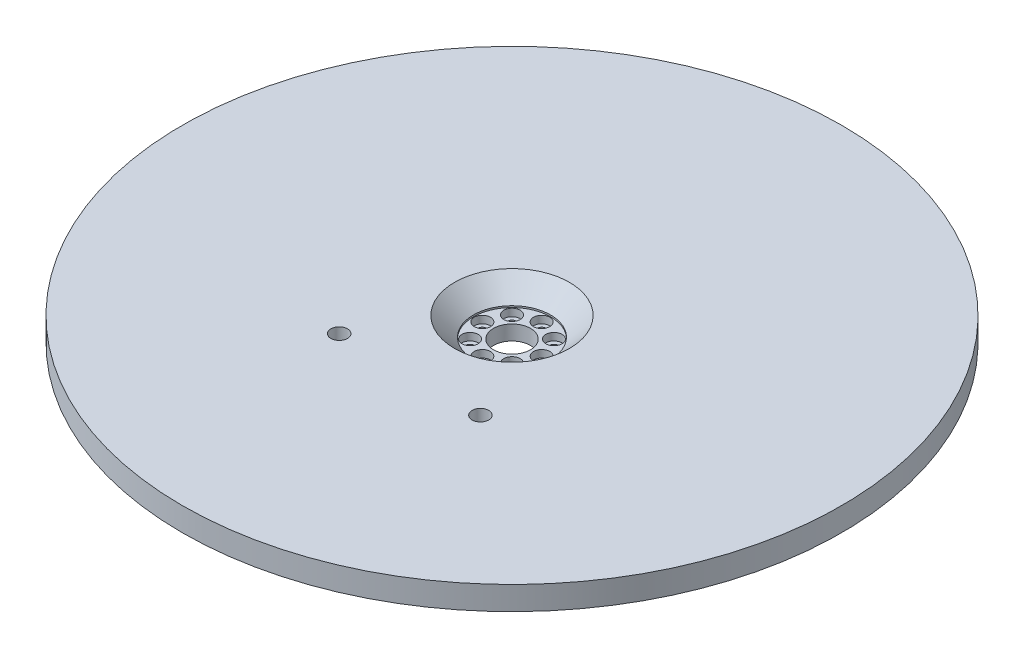
from build123d import *

# Parameters (mm, degrees)
SKETCH1_R                      = 88.9
BOSS_EXTRUDE1_DEPTH            = 3.175
SKETCH2_R                      = 12.065
BOSS_EXTRUDE2_DEPTH            = 3.175
SKETCH5_R                      = 10.4
CUT_EXTRUDE1_DEPTH             = 5.525
SKETCH6_R                      = 5
CUT_EXTRUDE2_DEPTH             = 4
CBORE_FOR_M2_SHCS1_D           = 2.2
CBORE_FOR_M2_SHCS1_DEPTH       = 6
CBORE_FOR_M2_SHCS1_CBORE_D     = 4.4
CBORE_FOR_M2_SHCS1_CBORE_DEPTH = 2
CBORE_FOR_M2_SHCS1_TIP         = 0.660946681
M4_CLEARANCE_HOLE1_D           = 4.5
CHAMFER1_SIZE                  = 5.08


with BuildPart() as part:
    # Sketch1 → Boss-Extrude1 (new, symmetric)
    with BuildSketch(Plane(origin=(0, 0, 0), x_dir=(1, 0, 0), z_dir=(0, 1, 0))):
        with Locations(Location((0, 0, 0), (0, 0, 270))):
            Circle(SKETCH1_R)
    extrude(amount=BOSS_EXTRUDE1_DEPTH, both=True)

    # Sketch2 → Boss-Extrude2 (add)
    with BuildSketch(Plane.XZ.offset(3.175)):
        with Locations(Location((0, 0, 0), (0, 0, 90))):
            Circle(SKETCH2_R)
    extrude(amount=BOSS_EXTRUDE2_DEPTH)

    # Sketch5 → Cut-Extrude1 (cut)
    with BuildSketch(Plane(origin=(0, 3.175, 0), x_dir=(1, 0, 0), z_dir=(0, 1, 0))):
        with Locations(Location((0, 0, 0), (0, 0, 270))):
            Circle(SKETCH5_R)
    extrude(amount=-CUT_EXTRUDE1_DEPTH, mode=Mode.SUBTRACT)

    # Sketch6 → Cut-Extrude2 (cut)
    with BuildSketch(Plane(origin=(0, -2.35, 0), x_dir=(1, 0, 0), z_dir=(0, 1, 0))):
        with Locations(Location((0, 0, 0), (0, 0, 270))):
            Circle(SKETCH6_R)
    extrude(amount=-CUT_EXTRUDE2_DEPTH, mode=Mode.SUBTRACT)

    # CBORE for M2 SHCS1
    with Locations(Plane(origin=(0, -2.35, 0), x_dir=(1, 0, 0), z_dir=(0, 1, 0))):
        with Locations((-5.65685425, 5.65685425), (0, 8), (5.65685425, 5.65685425), (8, 0), (5.65685425, -5.65685425), (0, -8), (-5.65685425, -5.65685425), (-8, 0)):
            CounterBoreHole(CBORE_FOR_M2_SHCS1_D / 2, CBORE_FOR_M2_SHCS1_CBORE_D / 2, CBORE_FOR_M2_SHCS1_CBORE_DEPTH, depth=CBORE_FOR_M2_SHCS1_DEPTH)
            with Locations((0, 0, -(CBORE_FOR_M2_SHCS1_DEPTH + CBORE_FOR_M2_SHCS1_TIP / 2))):  # 118° drill point
                Cone(0, CBORE_FOR_M2_SHCS1_D / 2, CBORE_FOR_M2_SHCS1_TIP, mode=Mode.SUBTRACT)

    # M4 Clearance Hole1 (through all)
    with Locations(Plane(origin=(0, 3.175, 0), x_dir=(1, 0, 0), z_dir=(0, 1, 0))):
        with Locations((19.05, -27.564242343), (-19.05, -27.564242343)):
            Hole(M4_CLEARANCE_HOLE1_D / 2)

    # Chamfer1
    chamfer1_edges = [part.edges().sort_by_distance(p)[0] for p in [
        (0, 3.175, -10.4),
    ]]
    chamfer(chamfer1_edges, length=CHAMFER1_SIZE)


solid = part.part
